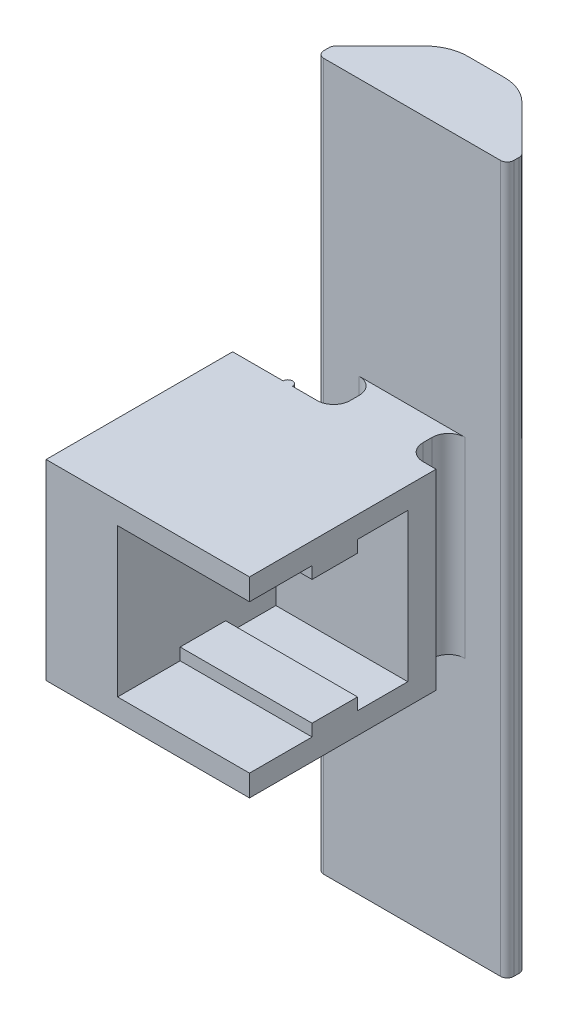
from build123d import *

# Parameters (mm, degrees)
BOSS_EXTRUDE6_DEPTH = 37.5
BOSS_EXTRUDE1_DEPTH = 10.16
CUT_EXTRUDE4_DEPTH  = 14


with BuildPart() as part:
    # Sketch15 → Boss-Extrude6 (new, symmetric)
    with BuildSketch(Plane(origin=(0, 0, 0), x_dir=(1, 0, 0), z_dir=(0, 1, 0))):
        with BuildLine():
            Line((-5.617617549, 4.264), (-9.385342517, 4.264))
            ThreePointArc((-9.385342517, 4.264), (-9.881519345, 4.469523172), (-10.087042517, 4.9657))
            Line((-10.087042517, 4.9657), (-10.087042517, 5.533957914))
            ThreePointArc((-10.087042517, 5.533957914), (-10.03362862, 5.802487278), (-9.881518735, 6.030135353))
            Line((-9.881518735, 6.030135353), (-5.15064406, 10.76099839))
            ThreePointArc((-5.15064406, 10.76099839), (-3.674584079, 11.747268168), (-1.933453584, 12.0936))
            Line((-1.933453584, 12.0936), (1.933453584, 12.0936))
            ThreePointArc((1.933453584, 12.0936), (3.674584079, 11.747268168), (5.15064406, 10.76099839))
            Line((5.15064406, 10.76099839), (9.881518735, 6.030135353))
            ThreePointArc((9.881518735, 6.030135353), (10.03362862, 5.802487278), (10.087042517, 5.533957914))
            Line((10.087042517, 5.533957914), (10.087042517, 4.9657))
            ThreePointArc((10.087042517, 4.9657), (9.881519345, 4.469523172), (9.385342517, 4.264))
            Line((9.385342517, 4.264), (5.617617549, 4.264))
            Line((5.617617549, 4.264), (-5.617617549, 4.264))
        make_face()
    extrude(amount=BOSS_EXTRUDE6_DEPTH, both=True)

    # Sketch1 → Boss-Extrude1 (add, symmetric)
    with BuildSketch(Plane(origin=(0, 0, 0), x_dir=(1, 0, 0), z_dir=(0, 1, 0))):
        with BuildLine():
            Line((-14.587702875, -0.2), (-14.587702875, -20))
            Line((-14.587702875, -20), (7, -20))
            Line((7, -20), (7, -0.2))
            Line((7, -0.2), (5.617617549, -0.2))
            ThreePointArc((5.617617549, -0.2), (4.377622689, 0.313622689), (3.864, 1.553617549))
            Line((3.864, 1.553617549), (3.864, 2.510382451))
            ThreePointArc((3.864, 2.510382451), (4.377622689, 3.750377311), (5.617617549, 4.264))
            Line((5.617617549, 4.264), (5.617617549, 5))
            Line((5.617617549, 5), (-5.617617549, 5))
            Line((-5.617617549, 5), (-5.617617549, 4.264))
            ThreePointArc((-5.617617549, 4.264), (-4.377622689, 3.750377311), (-3.864, 2.510382451))
            Line((-3.864, 2.510382451), (-3.864, 1.553617549))
            ThreePointArc((-3.864, 1.553617549), (-4.377622689, 0.313622689), (-5.617617549, -0.2))
            Line((-5.617617549, -0.2), (-8.236278456, -0.2))
            ThreePointArc((-8.236278456, -0.2), (-8.736202395, 0.29992394), (-9.236126335, -0.2))
            Line((-9.236126335, -0.2), (-14.587702875, -0.2))
        make_face()
    extrude(amount=BOSS_EXTRUDE1_DEPTH, both=True)

    # Sketch12 → Cut-Extrude4 (cut)
    with BuildSketch(Plane(origin=(7, 0, 0), x_dir=(0, 0, -1), z_dir=(1, 0, 0))):
        Polygon((-22.36, 7.874), (-22.36, -7.874), (-13.36, -7.874), (-13.36, -6.604), (-8.534, -6.604), (-8.534, -7.874), (-3.2, -7.874), (-3.2, 7.874), (-8.534, 7.874), (-8.534, 6.604), (-13.36, 6.604), (-13.36, 7.874), align=None)
    extrude(amount=-CUT_EXTRUDE4_DEPTH, mode=Mode.SUBTRACT)


solid = part.part
